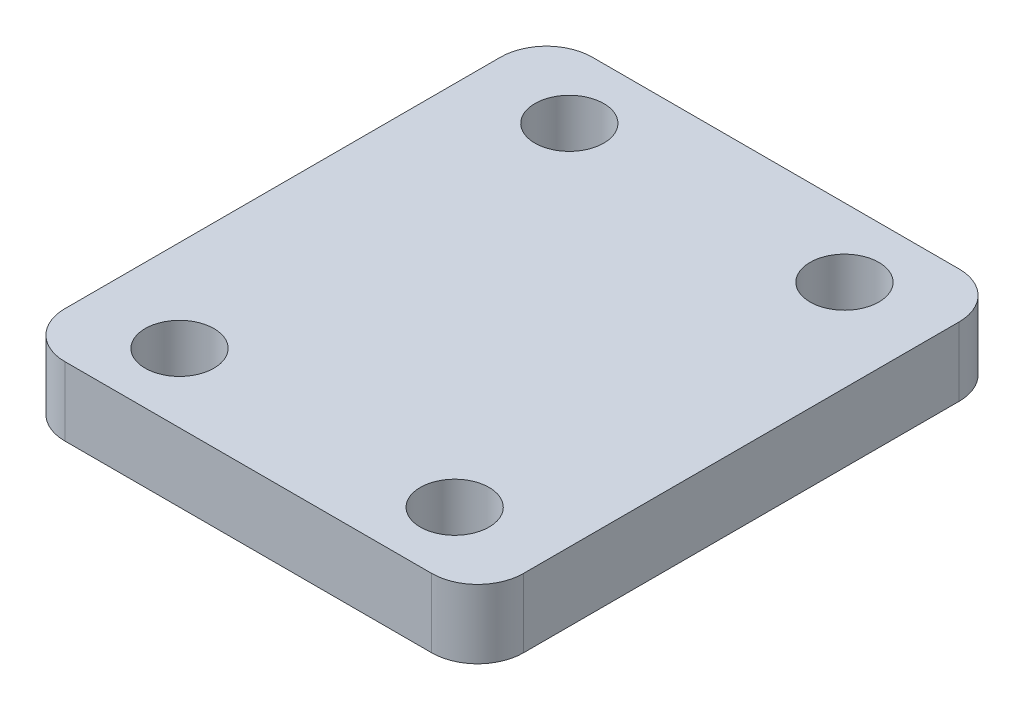
from build123d import *

# Parameters (mm, degrees)
SKETCH_1_W      = 20
SKETCH_1_H      = 23
SKETCH_1_R      = 1.5
EXTRUDE_1_DEPTH = 3
FILLET_1_R      = 2


with BuildPart() as part:
    # 草图1 → 凸台-拉伸1 (new body)
    with BuildSketch(Plane(origin=(0, 0, 0), x_dir=(1, 0, 0), z_dir=(0, 1, 0))):
        Rectangle(SKETCH_1_W, SKETCH_1_H)
        with Locations(Location((-6, 8.5, 0), (0, 0, 270))):
            Circle(SKETCH_1_R, mode=Mode.SUBTRACT)
        with Locations(Location((6, 8.5, 0), (0, 0, 90))):
            Circle(SKETCH_1_R, mode=Mode.SUBTRACT)
        with Locations(Location((6, -8.5, 0), (0, 0, 270))):
            Circle(SKETCH_1_R, mode=Mode.SUBTRACT)
        with Locations(Location((-6, -8.5, 0), (0, 0, 90))):
            Circle(SKETCH_1_R, mode=Mode.SUBTRACT)
    extrude(amount=EXTRUDE_1_DEPTH)

    # 圆角1
    fillet_1_edges = [part.edges().sort_by_distance(p)[0] for p in [
        (10, 1.5, 11.5),
        (-10, 1.5, 11.5),
        (-10, 1.5, -11.5),
        (10, 1.5, -11.5),
    ]]
    fillet(fillet_1_edges, radius=FILLET_1_R)


solid = part.part
